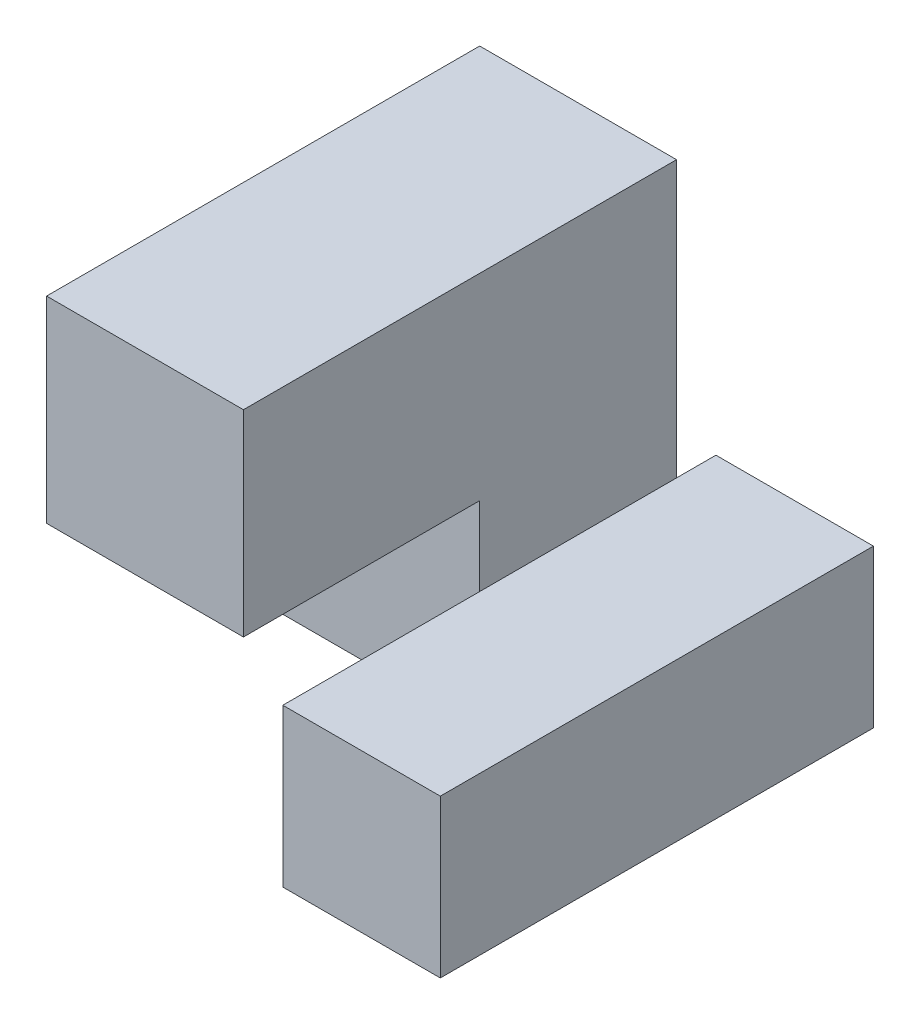
from build123d import *

# Parameters (mm, degrees)
SKETCH1_W           = 10
SKETCH1_H           = 20
BOSS_EXTRUDE1_DEPTH = 10
SKETCH2_W           = 10
SKETCH2_H           = 10
BOSS_EXTRUDE2_DEPTH = 22
SKETCH3_W           = 8
SKETCH3_H           = 8
BOSS_EXTRUDE3_DEPTH = 22


with BuildPart() as part:
    # Sketch1 → Boss-Extrude1 (new body)
    with BuildSketch(Plane.XY):
        with Locations((5, 10)):
            Rectangle(SKETCH1_W, SKETCH1_H)
    extrude(amount=BOSS_EXTRUDE1_DEPTH)

    # Sketch2 → Boss-Extrude2 (add)
    with BuildSketch(Plane.XY):
        with Locations((5, 15)):
            Rectangle(SKETCH2_W, SKETCH2_H)
    extrude(amount=BOSS_EXTRUDE2_DEPTH)


with BuildPart() as body_2:
    # Sketch3 → Boss-Extrude3 (new body)
    with BuildSketch(Plane.XY):
        with Locations((16, 4)):
            Rectangle(SKETCH3_W, SKETCH3_H)
    extrude(amount=BOSS_EXTRUDE3_DEPTH)


solid = Compound([part.part, body_2.part])
